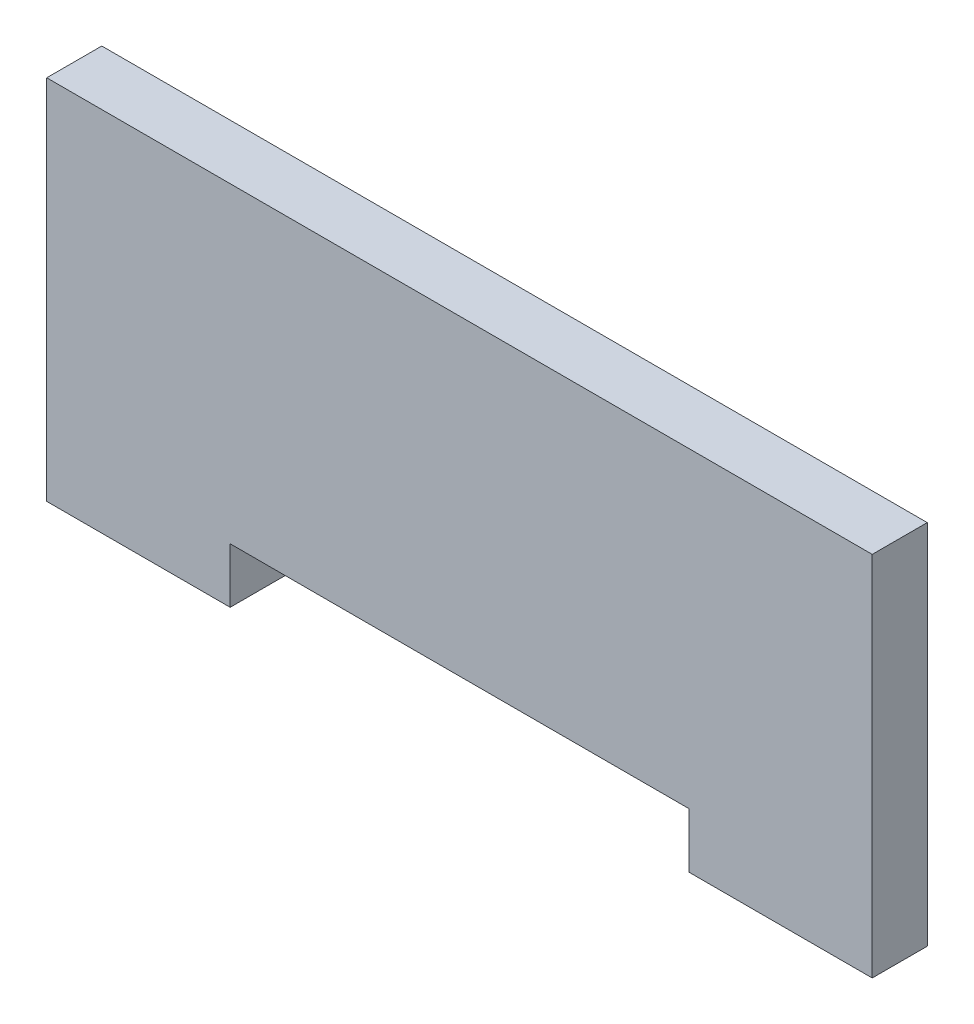
from build123d import *

# Parameters (mm, degrees)
SKETCH1_W           = 45
SKETCH1_H           = 20
BOSS_EXTRUDE1_DEPTH = 3
SKETCH2_W           = 25
SKETCH2_H           = 3
CUT_EXTRUDE1_DEPTH  = 3


with BuildPart() as part:
    # Sketch1 → Boss-Extrude1 (new body)
    with BuildSketch(Plane.XY):
        with Locations((22.5, 10)):
            Rectangle(SKETCH1_W, SKETCH1_H)
    extrude(amount=BOSS_EXTRUDE1_DEPTH)

    # Sketch2 → Cut-Extrude1 (cut)
    with BuildSketch(Plane.XY.offset(3)):
        with Locations((22.5, 1.5)):
            Rectangle(SKETCH2_W, SKETCH2_H)
    extrude(amount=-CUT_EXTRUDE1_DEPTH, mode=Mode.SUBTRACT)


solid = part.part
